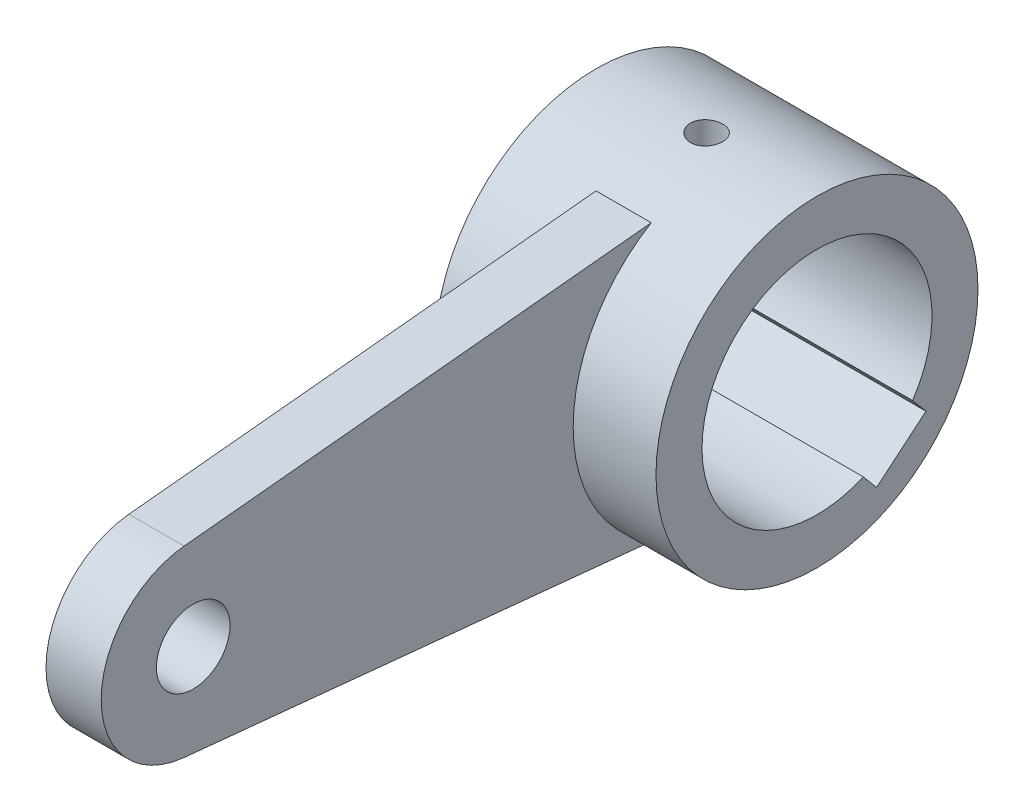
from build123d import *

# Parameters (mm, degrees)
SKETCH1_R           = 35
SKETCH1_R_2         = 25
BOSS_EXTRUDE1_DEPTH = 24
BOSS_EXTRUDE2_DEPTH = 6
SKETCH3_R           = 8
CUT_EXTRUDE1_DEPTH  = 15
CUT_EXTRUDE2_DEPTH  = 150.875815261
SKETCH6_R           = 3.5
CUT_EXTRUDE3_DEPTH  = 24


with BuildPart() as part:
    # Sketch1 → Boss-Extrude1 (new, symmetric)
    with BuildSketch(Plane(origin=(0, 0, 0), x_dir=(0, 0, -1), z_dir=(1, 0, 0))):
        Circle(SKETCH1_R)
        Circle(SKETCH1_R_2, mode=Mode.SUBTRACT)
    extrude(amount=BOSS_EXTRUDE1_DEPTH, both=True)

    # Sketch2 → Boss-Extrude2 (add, symmetric)
    with BuildSketch(Plane(origin=(0, 0, 0), x_dir=(0, 0, -1), z_dir=(1, 0, 0))):
        with BuildLine():
            Line((-18.027756377, 30), (-119.579019246, 19.901846216))
            ThreePointArc((-119.579019246, 19.901846216), (-137.6, 0), (-119.579019246, -19.901846216))
            Line((-119.579019246, -19.901846216), (-18.027756377, -30))
            ThreePointArc((-18.027756377, -30), (-35, 0), (-18.027756377, 30))
        make_face()
    extrude(amount=BOSS_EXTRUDE2_DEPTH, both=True)

    # Sketch3 → Cut-Extrude1 (cut)
    with BuildSketch(Plane(origin=(6, 0, 0), x_dir=(0, 0, -1), z_dir=(1, 0, 0))):
        with Locations((-117.6, 0)):
            Circle(SKETCH3_R)
    extrude(amount=-CUT_EXTRUDE1_DEPTH, mode=Mode.SUBTRACT)

    # Sketch5 → Cut-Extrude2 (cut, through all)
    with BuildSketch(Plane(origin=(24, 0, 0), x_dir=(0, 0, -1), z_dir=(1, 0, 0))):
        Polygon((23.681757978, -17.332753361), (12.957135774, -26.331779897), (3.997953594, -15.654642346), (14.722575797, -6.655615811), align=None)
    extrude(amount=-CUT_EXTRUDE2_DEPTH, mode=Mode.SUBTRACT)

    # Sketch6 → Cut-Extrude3 (cut)
    with BuildSketch(Plane(origin=(0, 35, 0), x_dir=(-1, 0, 0), z_dir=(0, 1, 0))):
        with Locations(Location((0, 0, 0), (0, 0, 90))):
            Circle(SKETCH6_R)
    extrude(amount=-CUT_EXTRUDE3_DEPTH, mode=Mode.SUBTRACT)


solid = part.part
